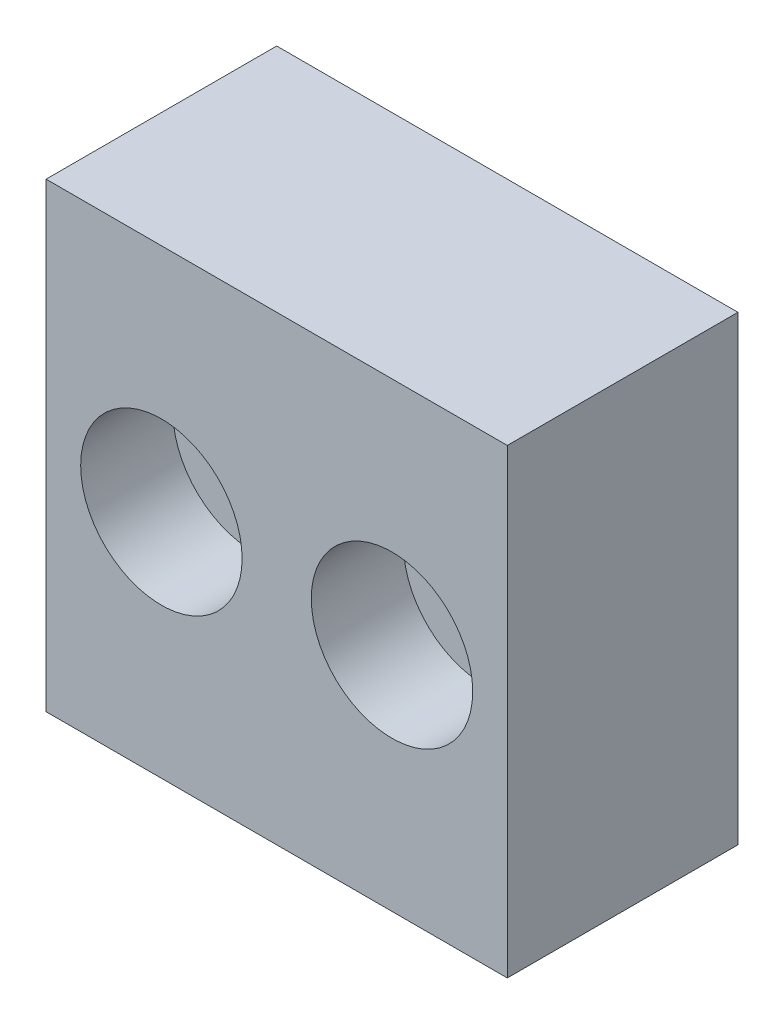
from build123d import *

# Parameters (mm, degrees)
ESBO_O1_W                                           = 20
ESBO_O1_H                                           = 20
RESSALTO_EXTRUS_O1_DEPTH                            = 10
REBAIXO_PARA_PARAFUSO_COM_CABE_A_PANELA_D           = 4.3
REBAIXO_PARA_PARAFUSO_COM_CABE_A_PANELA_CBORE_D     = 7
REBAIXO_PARA_PARAFUSO_COM_CABE_A_PANELA_CBORE_DEPTH = 4


with BuildPart() as part:
    # Esboço1 → Ressalto-extrusão1 (new body)
    with BuildSketch(Plane.XY):
        Rectangle(ESBO_O1_W, ESBO_O1_H)
    extrude(amount=RESSALTO_EXTRUS_O1_DEPTH)

    # Rebaixo para parafuso com cabeça panela de M41 (through all)
    with Locations(Plane.XY.offset(10)):
        with Locations((5, 0), (-5, 0)):
            CounterBoreHole(REBAIXO_PARA_PARAFUSO_COM_CABE_A_PANELA_D / 2, REBAIXO_PARA_PARAFUSO_COM_CABE_A_PANELA_CBORE_D / 2, REBAIXO_PARA_PARAFUSO_COM_CABE_A_PANELA_CBORE_DEPTH)


solid = part.part
